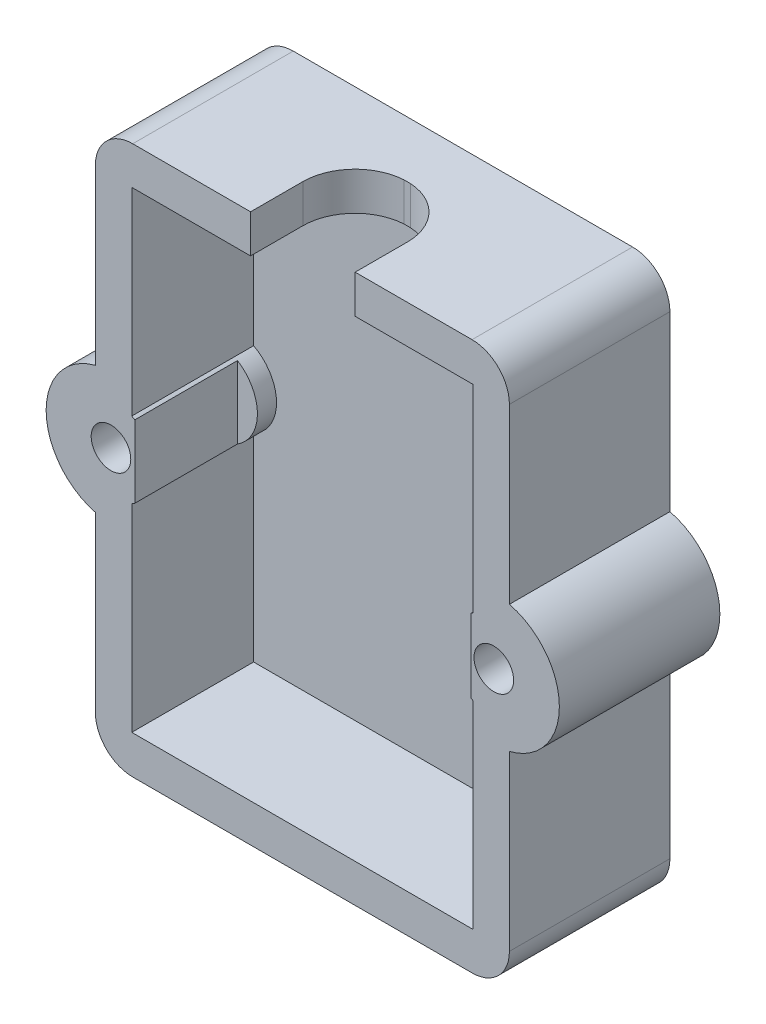
from build123d import *

# Parameters (mm, degrees)
BOSS_EXTRUDE2_DEPTH = 8.595
CUT_EXTRUDE3_REACH  = 34.514
SKETCH5_R           = 1.06
CUT_EXTRUDE4_DEPTH  = 6.525
CUT_EXTRUDE2_REACH  = 35.545
SKETCH7_W           = 18
SKETCH7_H           = 24.65
CUT_EXTRUDE6_DEPTH  = 5.5


with BuildPart() as part:
    # Sketch1 → Boss-Extrude2 (new body)
    with BuildSketch(Plane.XY):
        with BuildLine():
            Line((-11.11, 0.816412174), (-11.11, 10.090766215))
            ThreePointArc((-11.11, 10.090766215), (-13.747229408, 13.5), (-11.11, 16.909233785))
            Line((-11.11, 16.909233785), (-11.11, 26.183587826))
            ThreePointArc((-11.11, 26.183587826), (-10.524213562, 27.597801388), (-9.11, 28.183587826))
            Line((-9.11, 28.183587826), (9.06, 28.183587826))
            ThreePointArc((9.06, 28.183587826), (10.474213562, 27.597801388), (11.06, 26.183587826))
            Line((11.06, 26.183587826), (11.06, 16.909233785))
            ThreePointArc((11.06, 16.909233785), (13.735, 13.5), (11.06, 10.090766215))
            Line((11.06, 10.090766215), (11.06, 0.816412174))
            ThreePointArc((11.06, 0.816412174), (10.474213562, -0.597801388), (9.06, -1.183587826))
            Line((9.06, -1.183587826), (-9.11, -1.183587826))
            ThreePointArc((-9.11, -1.183587826), (-10.524213562, -0.597801388), (-11.11, 0.816412174))
        make_face()
    extrude(amount=BOSS_EXTRUDE2_DEPTH)

    # Sketch5 → Cut-Extrude3 (cut, up to next)
    with BuildSketch(Plane.XY.offset(8.595), mode=Mode.PRIVATE) as cut_extrude3_sk1:
        with Locations((-10.275, 13.5)):
            Circle(SKETCH5_R)
    cut_extrude3_tool1 = extrude(cut_extrude3_sk1.sketch, amount=-CUT_EXTRUDE3_REACH, mode=Mode.PRIVATE) & part.part
    # Sketch5 → Cut-Extrude3 (cut, up to next)
    with BuildSketch(Plane.XY.offset(8.595), mode=Mode.PRIVATE) as cut_extrude3_sk2:
        with Locations(Location((10.225, 13.5, 0), (0, 0, 180))):
            Circle(SKETCH5_R)
    cut_extrude3_tool2 = extrude(cut_extrude3_sk2.sketch, amount=-CUT_EXTRUDE3_REACH, mode=Mode.PRIVATE) & part.part
    add(cut_extrude3_tool1.solids().sort_by_distance((-10.275, 13.5, 8.595))[0], mode=Mode.SUBTRACT)
    add(cut_extrude3_tool2.solids().sort_by_distance((10.225, 13.5, 8.595))[0], mode=Mode.SUBTRACT)

    # Sketch2 → Cut-Extrude4 (cut)
    with BuildSketch(Plane.XY.offset(8.595)):
        with BuildLine():
            Line((-9.1625, 15.528570386), (-9.1625, 26.136412174))
            Line((-9.1625, 26.136412174), (9.1125, 26.136412174))
            Line((9.1125, 26.136412174), (9.1125, 15.528570386))
            ThreePointArc((9.1125, 15.528570386), (7.885020948, 13.5), (9.1125, 11.471429614))
            Line((9.1125, 11.471429614), (9.1125, 0.861412174))
            Line((9.1125, 0.861412174), (-9.1625, 0.861412174))
            Line((-9.1625, 0.861412174), (-9.1625, 11.471429614))
            ThreePointArc((-9.1625, 11.471429614), (-7.935020948, 13.5), (-9.1625, 15.528570386))
        make_face()
    extrude(amount=-CUT_EXTRUDE4_DEPTH, mode=Mode.SUBTRACT)

    # Sketch3 → Cut-Extrude2 (cut, up to next)
    with BuildSketch(Plane(origin=(0, 28.183587826, 0), x_dir=(1, 0, 0), z_dir=(0, 1, 0)), mode=Mode.PRIVATE) as cut_extrude2_sk1:
        with BuildLine():
            Line((0.167257287, -3.005), (-0.167257287, -3.005))
            ThreePointArc((-0.167257287, -3.005), (-2.038175704, -3.880145891), (-2.8, -5.8))
            Line((-2.8, -5.8), (-2.8, -8.595))
            Line((-2.8, -8.595), (-0.167257287, -8.595))
            Line((-0.167257287, -8.595), (0.167257287, -8.595))
            Line((0.167257287, -8.595), (2.8, -8.595))
            Line((2.8, -8.595), (2.8, -5.8))
            ThreePointArc((2.8, -5.8), (2.038175704, -3.880145891), (0.167257287, -3.005))
        make_face()
    cut_extrude2_tool1 = extrude(cut_extrude2_sk1.sketch, amount=-CUT_EXTRUDE2_REACH, mode=Mode.PRIVATE) & part.part
    add(cut_extrude2_tool1.solids().sort_by_distance((0, 28.183588, 6.058962))[0], mode=Mode.SUBTRACT)

    # Sketch7 → Cut-Extrude6 (cut)
    with BuildSketch(Plane.XY.offset(8.595)):
        with Locations((0, 13.548319596)):
            Rectangle(SKETCH7_W, SKETCH7_H)
    extrude(amount=-CUT_EXTRUDE6_DEPTH, mode=Mode.SUBTRACT)


solid = part.part
